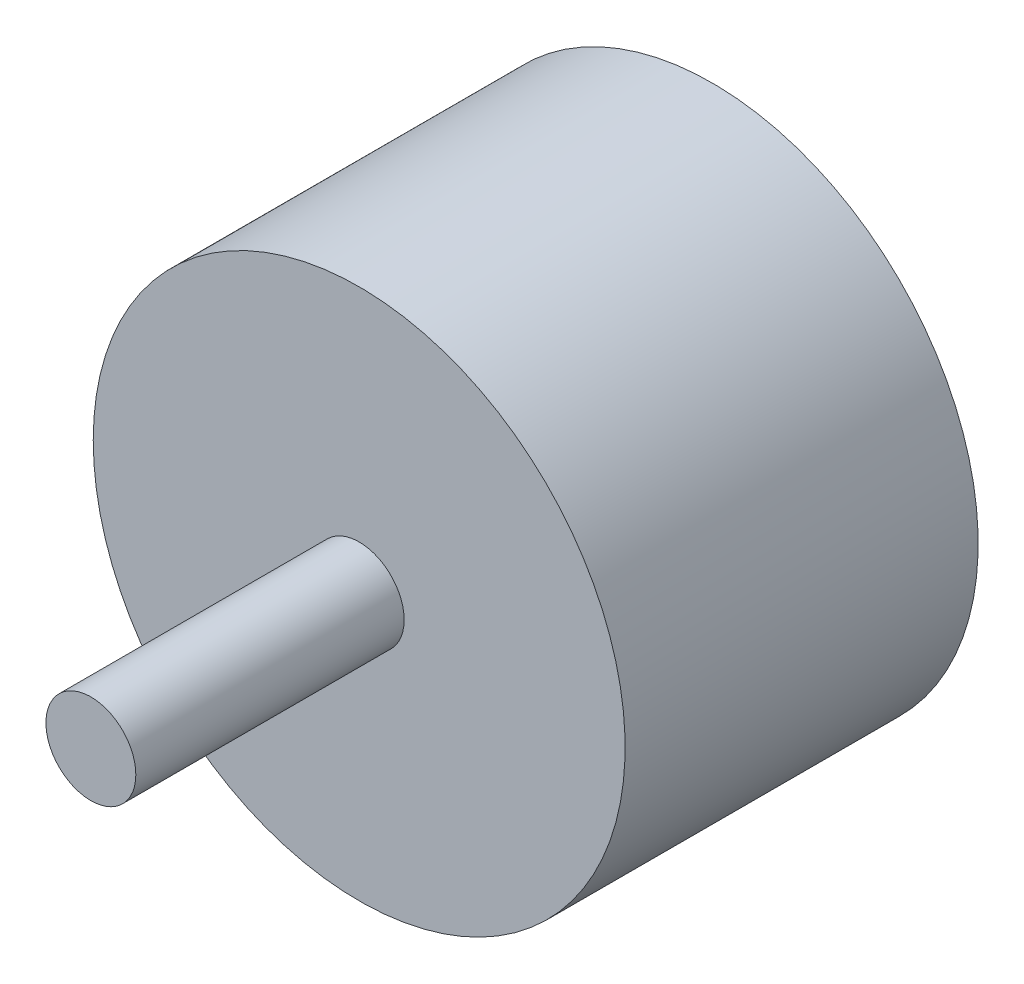
from build123d import *

# Parameters (mm, degrees)
SKETCH1_R           = 14.351
BOSS_EXTRUDE1_DEPTH = 19.05
SKETCH2_R           = 2.4257
BOSS_EXTRUDE2_DEPTH = 14.478
SKETCH3_R           = 1.2065
CUT_EXTRUDE1_DEPTH  = 5.08


with BuildPart() as part:
    # Sketch1 → Boss-Extrude1 (new body)
    with BuildSketch(Plane.XY):
        with Locations(Location((0, 0, 0), (0, 0, 180))):
            Circle(SKETCH1_R)
    extrude(amount=BOSS_EXTRUDE1_DEPTH)

    # Sketch2 → Boss-Extrude2 (add)
    with BuildSketch(Plane.XY.offset(19.05)):
        Circle(SKETCH2_R)
    extrude(amount=BOSS_EXTRUDE2_DEPTH)

    # Sketch3 → Cut-Extrude1 (cut)
    with BuildSketch(Plane(origin=(0, 0, 0), x_dir=(-1, 0, 0), z_dir=(0, 0, -1))):
        with Locations((0, 8.001)):
            Circle(SKETCH3_R)
        with Locations((9.525, 0)):
            Circle(SKETCH3_R)
        with Locations((0, -8.001)):
            Circle(SKETCH3_R)
        with Locations((-9.525, 0)):
            Circle(SKETCH3_R)
    extrude(amount=-CUT_EXTRUDE1_DEPTH, mode=Mode.SUBTRACT)


solid = part.part
